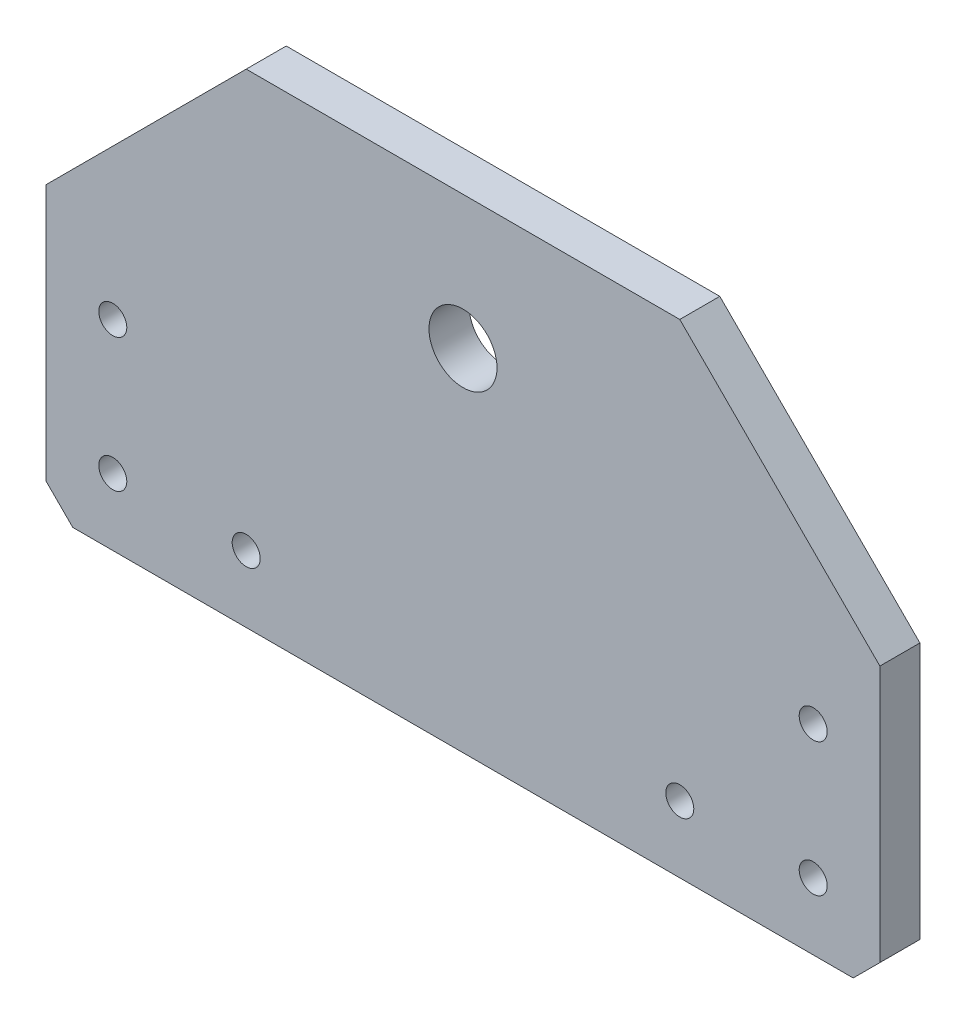
from build123d import *

# Parameters (mm, degrees)
SKETCH_1_W      = 125
SKETCH_1_H      = 72.5
SKETCH_1_R      = 5.1
SKETCH_1_R_2    = 2.1
EXTRUDE_1_DEPTH = 3
CHAMFER_1_SIZE  = 30
CHAMFER_2_SIZE  = 4
CHAMFER_3_SIZE  = 2


with BuildPart() as part:
    # 草图1 → 凸台-拉伸1 (new, symmetric)
    with BuildSketch(Plane.XY):
        with Locations((0, -16.25)):
            Rectangle(SKETCH_1_W, SKETCH_1_H)
        Circle(SKETCH_1_R, mode=Mode.SUBTRACT)
        with Locations((-32.5, -42.5)):
            Circle(SKETCH_1_R_2, mode=Mode.SUBTRACT)
        with Locations((32.5, -42.5)):
            Circle(SKETCH_1_R_2, mode=Mode.SUBTRACT)
        with Locations((-52.5, -42.5)):
            Circle(SKETCH_1_R_2, mode=Mode.SUBTRACT)
        with Locations((52.5, -42.5)):
            Circle(SKETCH_1_R_2, mode=Mode.SUBTRACT)
        with Locations((-52.5, -22.5)):
            Circle(SKETCH_1_R_2, mode=Mode.SUBTRACT)
        with Locations((52.5, -22.5)):
            Circle(SKETCH_1_R_2, mode=Mode.SUBTRACT)
    extrude(amount=EXTRUDE_1_DEPTH, both=True)

    # 倒角1
    chamfer_1_edges = [part.edges().sort_by_distance(p)[0] for p in [
        (62.5, 20, 0),
        (-62.5, 20, 0),
    ]]
    chamfer(chamfer_1_edges, length=CHAMFER_1_SIZE)

    # 倒角2
    chamfer_2_edges = [part.edges().sort_by_distance(p)[0] for p in [
        (62.5, -52.5, 0),
        (-62.5, -52.5, 0),
    ]]
    chamfer(chamfer_2_edges, length=CHAMFER_2_SIZE)

    # 倒角3
    chamfer_3_edges = [part.edges().sort_by_distance(p)[0] for p in [
        (-54.6, -42.5, -3),
        (50.4, -42.5, -3),
        (-54.6, -22.5, -3),
        (50.4, -22.5, -3),
    ]]
    chamfer(chamfer_3_edges, length=CHAMFER_3_SIZE)


solid = part.part
